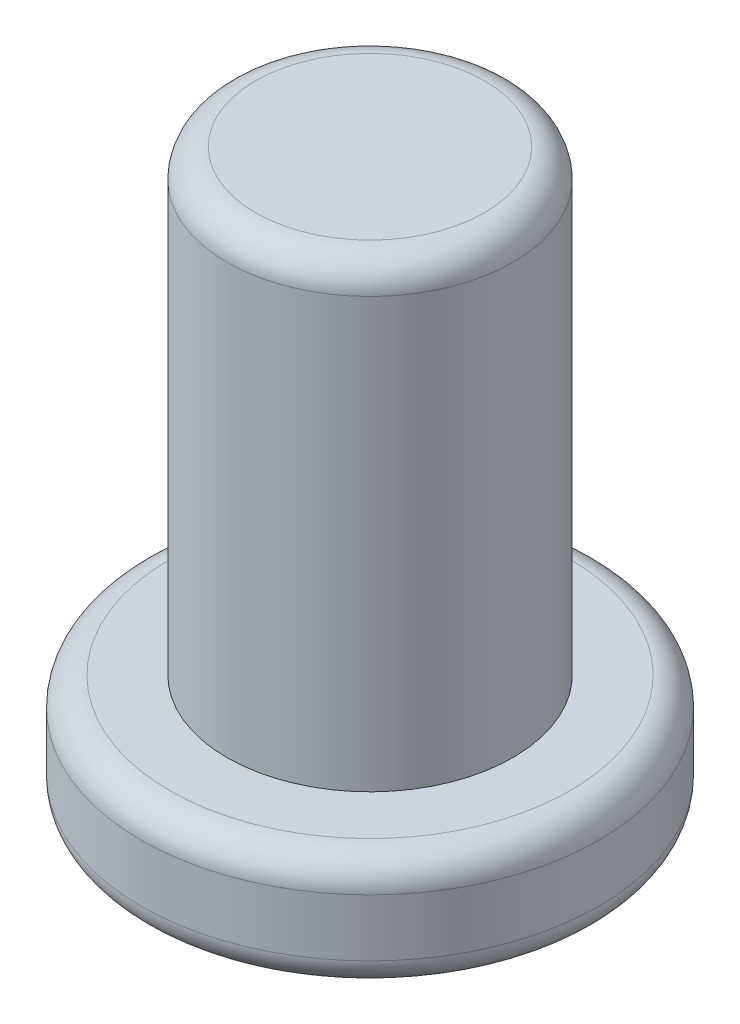
from build123d import *

# Parameters (mm, degrees)
SKETCH1_R           = 4
BOSS_EXTRUDE1_DEPTH = 2
SKETCH2_R           = 2.5
BOSS_EXTRUDE2_DEPTH = 8
FILLET1_R           = 0.5
FILLET2_R           = 0.5
FILLET3_R           = 0.5


with BuildPart() as part:
    # Sketch1 → Boss-Extrude1 (new body)
    with BuildSketch(Plane(origin=(0, 0, 0), x_dir=(1, 0, 0), z_dir=(0, 1, 0))):
        with Locations(Location((0, 0, 0), (0, 0, 270))):
            Circle(SKETCH1_R)
    extrude(amount=BOSS_EXTRUDE1_DEPTH)

    # Sketch2 → Boss-Extrude2 (add)
    with BuildSketch(Plane(origin=(0, 2, 0), x_dir=(1, 0, 0), z_dir=(0, 1, 0))):
        with Locations(Location((0, 0, 0), (0, 0, 270))):
            Circle(SKETCH2_R)
    extrude(amount=BOSS_EXTRUDE2_DEPTH)

    # Fillet1
    fillet1_edges = [part.edges().sort_by_distance(p)[0] for p in [
        (0, 0, -4),
    ]]
    fillet(fillet1_edges, radius=FILLET1_R)

    # Fillet2
    fillet2_edges = [part.edges().sort_by_distance(p)[0] for p in [
        (0, 2, -4),
    ]]
    fillet(fillet2_edges, radius=FILLET2_R)

    # Fillet3
    fillet3_edges = [part.edges().sort_by_distance(p)[0] for p in [
        (0, 10, -2.5),
    ]]
    fillet(fillet3_edges, radius=FILLET3_R)


solid = part.part
